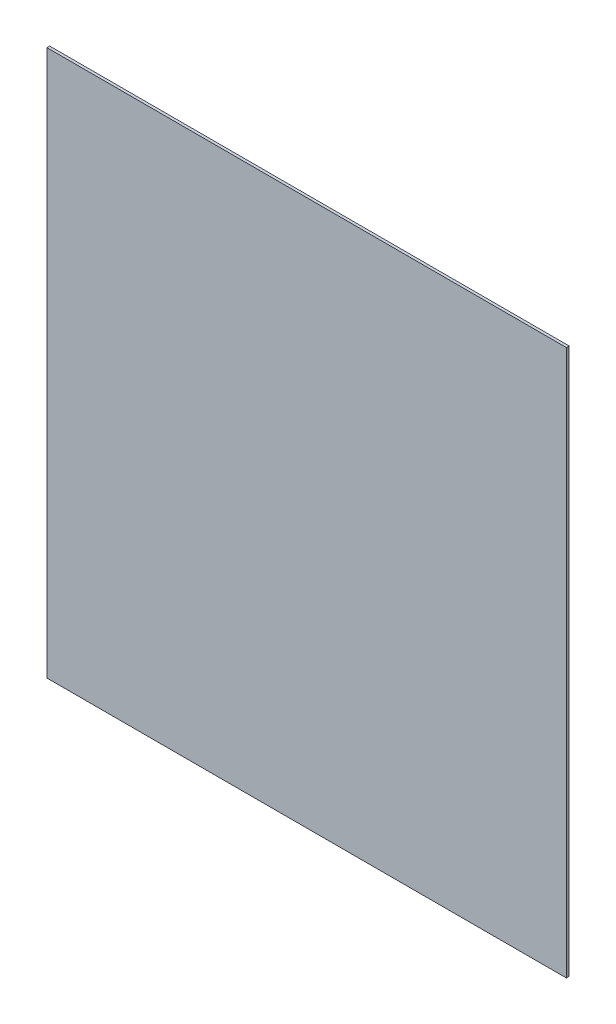
from build123d import *

# Parameters (mm, degrees)
SKETCH1_W      = 951.660443771
SKETCH1_H      = 1000
EXTRUDE1_DEPTH = 5


with BuildPart() as part:
    # Sketch1 → Extrude1 (new body)
    with BuildSketch(Plane.XY):
        with Locations((-24.169778115, -508)):
            Rectangle(SKETCH1_W, SKETCH1_H)
    extrude(amount=-EXTRUDE1_DEPTH)


solid = part.part
